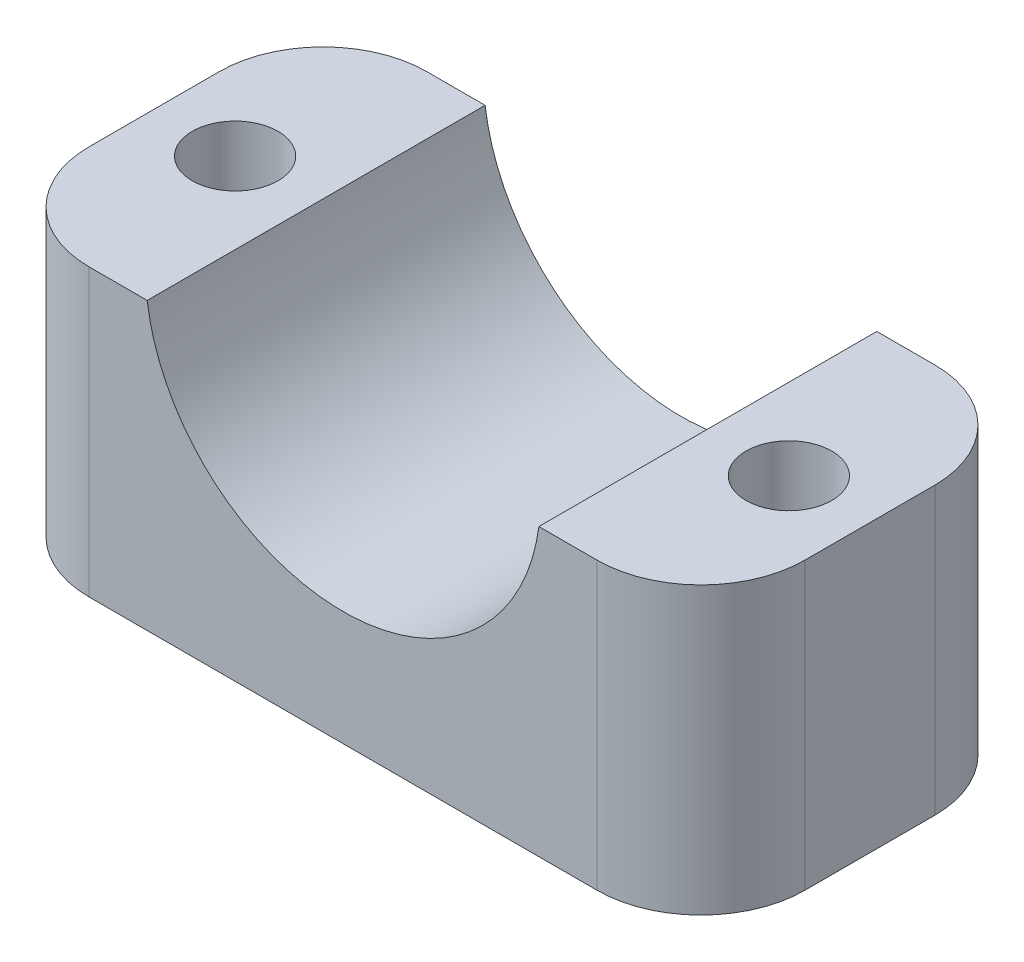
from build123d import *

# Parameters (mm, degrees)
BOSS_EXTRUDE1_DEPTH = 13
SKETCH2_R           = 1.65
CUT_EXTRUDE1_DEPTH  = 22.90006621
FILLET2_R           = 4


with BuildPart() as part:
    # Sketch1 → Boss-Extrude1 (new body)
    with BuildSketch(Plane.XY):
        with BuildLine():
            Line((-13.77, 5.5), (-13.77, -5.5))
            Line((-13.77, -5.5), (13.77, -5.5))
            Line((13.77, -5.5), (13.77, 5.5))
            Line((13.77, 5.5), (7.533923281, 5.5))
            ThreePointArc((7.533923281, 5.5), (0, -1.1), (-7.533923281, 5.5))
            Line((-7.533923281, 5.5), (-13.77, 5.5))
        make_face()
    extrude(amount=BOSS_EXTRUDE1_DEPTH)

    # Sketch2 → Cut-Extrude1 (cut, through all)
    with BuildSketch(Plane(origin=(0, 5.5, 0), x_dir=(1, 0, 0), z_dir=(0, 1, 0))):
        with Locations(Location((-10.65196164, -6.5, 0), (0, 0, 270))):
            Circle(SKETCH2_R)
        with Locations(Location((10.65196164, -6.5, 0), (0, 0, 270))):
            Circle(SKETCH2_R)
    extrude(amount=-CUT_EXTRUDE1_DEPTH, mode=Mode.SUBTRACT)

    # Fillet2
    fillet2_edges = [part.edges().sort_by_distance(p)[0] for p in [
        (-13.77, 0, 13),
        (13.77, 0, 13),
        (13.77, 0, 0),
        (-13.77, 0, 0),
    ]]
    fillet(fillet2_edges, radius=FILLET2_R)


solid = part.part
